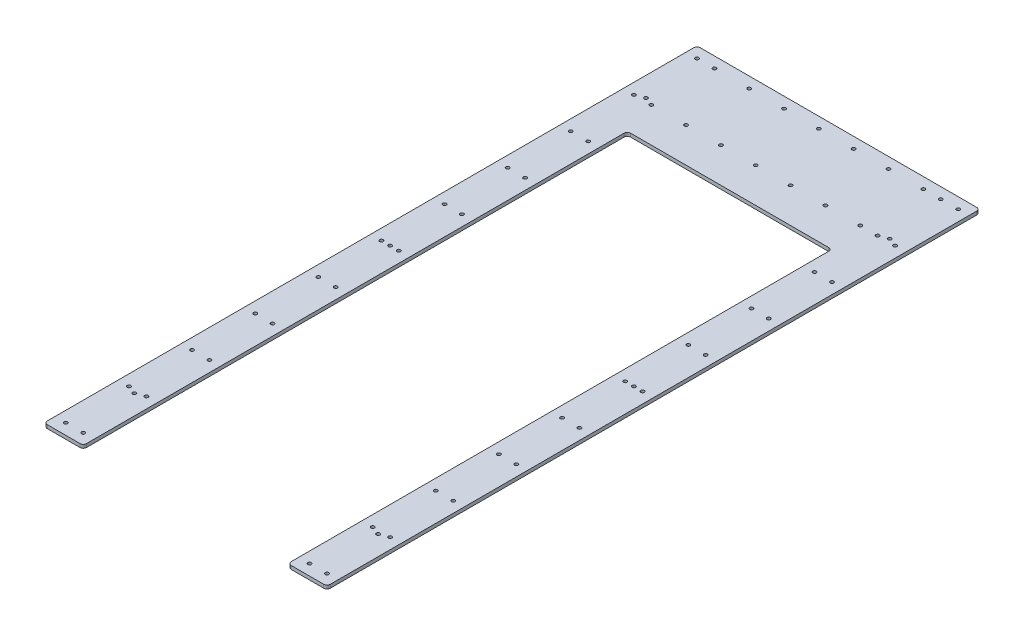
from build123d import *

# Parameters (mm, degrees)
SKETCH1_R           = 1.6
BOSS_EXTRUDE1_DEPTH = 3.175
FILLET1_R           = 3


with BuildPart() as part:
    # Sketch1 → Boss-Extrude1 (new body)
    with BuildSketch(Plane(origin=(0, 0, 0), x_dir=(1, 0, 0), z_dir=(0, 1, 0))):
        Polygon((-130, -300), (-94, -300), (-94, 200), (94, 200), (94, -300), (130, -300), (130, 300), (-130, 300), align=None)
        with Locations(Location((120, 290, 0), (0, 0, 270))):
            Circle(SKETCH1_R, mode=Mode.SUBTRACT)
        with Locations(Location((120, 232, 0), (0, 0, 270))):
            Circle(SKETCH1_R, mode=Mode.SUBTRACT)
        with Locations(Location((120, 174, 0), (0, 0, 270))):
            Circle(SKETCH1_R, mode=Mode.SUBTRACT)
        with Locations(Location((120, 116, 0), (0, 0, 270))):
            Circle(SKETCH1_R, mode=Mode.SUBTRACT)
        with Locations(Location((120, 58, 0), (0, 0, 270))):
            Circle(SKETCH1_R, mode=Mode.SUBTRACT)
        with Locations(Location((120, 0, 0), (0, 0, 270))):
            Circle(SKETCH1_R, mode=Mode.SUBTRACT)
        with Locations(Location((120, -58, 0), (0, 0, 270))):
            Circle(SKETCH1_R, mode=Mode.SUBTRACT)
        with Locations(Location((120, -116, 0), (0, 0, 270))):
            Circle(SKETCH1_R, mode=Mode.SUBTRACT)
        with Locations(Location((120, -174, 0), (0, 0, 270))):
            Circle(SKETCH1_R, mode=Mode.SUBTRACT)
        with Locations(Location((120, -232, 0), (0, 0, 270))):
            Circle(SKETCH1_R, mode=Mode.SUBTRACT)
        with Locations(Location((120, -290, 0), (0, 0, 270))):
            Circle(SKETCH1_R, mode=Mode.SUBTRACT)
        with Locations(Location((-120, 232, 0), (0, 0, 90))):
            Circle(SKETCH1_R, mode=Mode.SUBTRACT)
        with Locations(Location((-120, -290, 0), (0, 0, 90))):
            Circle(SKETCH1_R, mode=Mode.SUBTRACT)
        with Locations(Location((-120, -232, 0), (0, 0, 90))):
            Circle(SKETCH1_R, mode=Mode.SUBTRACT)
        with Locations(Location((-120, -174, 0), (0, 0, 90))):
            Circle(SKETCH1_R, mode=Mode.SUBTRACT)
        with Locations(Location((-120, -116, 0), (0, 0, 90))):
            Circle(SKETCH1_R, mode=Mode.SUBTRACT)
        with Locations(Location((-120, -58, 0), (0, 0, 90))):
            Circle(SKETCH1_R, mode=Mode.SUBTRACT)
        with Locations(Location((-120, 0, 0), (0, 0, 90))):
            Circle(SKETCH1_R, mode=Mode.SUBTRACT)
        with Locations(Location((-120, 58, 0), (0, 0, 90))):
            Circle(SKETCH1_R, mode=Mode.SUBTRACT)
        with Locations(Location((-120, 116, 0), (0, 0, 90))):
            Circle(SKETCH1_R, mode=Mode.SUBTRACT)
        with Locations(Location((-120, 174, 0), (0, 0, 90))):
            Circle(SKETCH1_R, mode=Mode.SUBTRACT)
        with Locations(Location((-120, 290, 0), (0, 0, 90))):
            Circle(SKETCH1_R, mode=Mode.SUBTRACT)
        with Locations(Location((112, 235, 0), (0, 0, 270))):
            Circle(SKETCH1_R, mode=Mode.SUBTRACT)
        with Locations(Location((-112, 235, 0), (0, 0, 90))):
            Circle(SKETCH1_R, mode=Mode.SUBTRACT)
        with Locations(Location((112, -235, 0), (0, 0, 90))):
            Circle(SKETCH1_R, mode=Mode.SUBTRACT)
        with Locations(Location((-112, -235, 0), (0, 0, 270))):
            Circle(SKETCH1_R, mode=Mode.SUBTRACT)
        with Locations(Location((104, 290, 0), (0, 0, 270))):
            Circle(SKETCH1_R, mode=Mode.SUBTRACT)
        with Locations(Location((104, 232, 0), (0, 0, 270))):
            Circle(SKETCH1_R, mode=Mode.SUBTRACT)
        with Locations(Location((104, 174, 0), (0, 0, 270))):
            Circle(SKETCH1_R, mode=Mode.SUBTRACT)
        with Locations(Location((104, 116, 0), (0, 0, 270))):
            Circle(SKETCH1_R, mode=Mode.SUBTRACT)
        with Locations(Location((104, 58, 0), (0, 0, 270))):
            Circle(SKETCH1_R, mode=Mode.SUBTRACT)
        with Locations(Location((104, 0, 0), (0, 0, 270))):
            Circle(SKETCH1_R, mode=Mode.SUBTRACT)
        with Locations(Location((104, -58, 0), (0, 0, 270))):
            Circle(SKETCH1_R, mode=Mode.SUBTRACT)
        with Locations(Location((104, -116, 0), (0, 0, 270))):
            Circle(SKETCH1_R, mode=Mode.SUBTRACT)
        with Locations(Location((104, -174, 0), (0, 0, 270))):
            Circle(SKETCH1_R, mode=Mode.SUBTRACT)
        with Locations(Location((104, -232, 0), (0, 0, 270))):
            Circle(SKETCH1_R, mode=Mode.SUBTRACT)
        with Locations(Location((104, -290, 0), (0, 0, 270))):
            Circle(SKETCH1_R, mode=Mode.SUBTRACT)
        with Locations(Location((-104, -290, 0), (0, 0, 90))):
            Circle(SKETCH1_R, mode=Mode.SUBTRACT)
        with Locations(Location((-104, -232, 0), (0, 0, 90))):
            Circle(SKETCH1_R, mode=Mode.SUBTRACT)
        with Locations(Location((-104, -174, 0), (0, 0, 90))):
            Circle(SKETCH1_R, mode=Mode.SUBTRACT)
        with Locations(Location((-104, -116, 0), (0, 0, 90))):
            Circle(SKETCH1_R, mode=Mode.SUBTRACT)
        with Locations(Location((-104, -58, 0), (0, 0, 90))):
            Circle(SKETCH1_R, mode=Mode.SUBTRACT)
        with Locations(Location((-104, 0, 0), (0, 0, 90))):
            Circle(SKETCH1_R, mode=Mode.SUBTRACT)
        with Locations(Location((-104, 58, 0), (0, 0, 90))):
            Circle(SKETCH1_R, mode=Mode.SUBTRACT)
        with Locations(Location((-104, 116, 0), (0, 0, 90))):
            Circle(SKETCH1_R, mode=Mode.SUBTRACT)
        with Locations(Location((-104, 174, 0), (0, 0, 90))):
            Circle(SKETCH1_R, mode=Mode.SUBTRACT)
        with Locations(Location((-104, 232, 0), (0, 0, 90))):
            Circle(SKETCH1_R, mode=Mode.SUBTRACT)
        with Locations(Location((-104, 290, 0), (0, 0, 90))):
            Circle(SKETCH1_R, mode=Mode.SUBTRACT)
        with Locations(Location((112, 0, 0), (0, 0, 270))):
            Circle(SKETCH1_R, mode=Mode.SUBTRACT)
        with Locations(Location((-112, 0, 0), (0, 0, 90))):
            Circle(SKETCH1_R, mode=Mode.SUBTRACT)
        with Locations(Location((-72, 290, 0), (0, 0, 90))):
            Circle(SKETCH1_R, mode=Mode.SUBTRACT)
        with Locations(Location((-40, 290, 0), (0, 0, 90))):
            Circle(SKETCH1_R, mode=Mode.SUBTRACT)
        with Locations(Location((-8, 290, 0), (0, 0, 90))):
            Circle(SKETCH1_R, mode=Mode.SUBTRACT)
        with Locations(Location((24, 290, 0), (0, 0, 90))):
            Circle(SKETCH1_R, mode=Mode.SUBTRACT)
        with Locations(Location((56, 290, 0), (0, 0, 90))):
            Circle(SKETCH1_R, mode=Mode.SUBTRACT)
        with Locations(Location((88, 290, 0), (0, 0, 90))):
            Circle(SKETCH1_R, mode=Mode.SUBTRACT)
        with Locations(Location((-72, 232, 0), (0, 0, 90))):
            Circle(SKETCH1_R, mode=Mode.SUBTRACT)
        with Locations(Location((-40, 232, 0), (0, 0, 90))):
            Circle(SKETCH1_R, mode=Mode.SUBTRACT)
        with Locations(Location((-8, 232, 0), (0, 0, 90))):
            Circle(SKETCH1_R, mode=Mode.SUBTRACT)
        with Locations(Location((24, 232, 0), (0, 0, 90))):
            Circle(SKETCH1_R, mode=Mode.SUBTRACT)
        with Locations(Location((56, 232, 0), (0, 0, 90))):
            Circle(SKETCH1_R, mode=Mode.SUBTRACT)
        with Locations(Location((88, 232, 0), (0, 0, 90))):
            Circle(SKETCH1_R, mode=Mode.SUBTRACT)
    extrude(amount=BOSS_EXTRUDE1_DEPTH)

    # Fillet1
    fillet1_edges = [part.edges().sort_by_distance(p)[0] for p in [
        (130, 1.5875, 300),
        (94, 1.5875, 300),
        (94, 1.5875, -200),
        (-94, 1.5875, -200),
        (-94, 1.5875, 300),
        (-130, 1.5875, 300),
        (-130, 1.5875, -300),
        (130, 1.5875, -300),
    ]]
    fillet(fillet1_edges, radius=FILLET1_R)


solid = part.part
